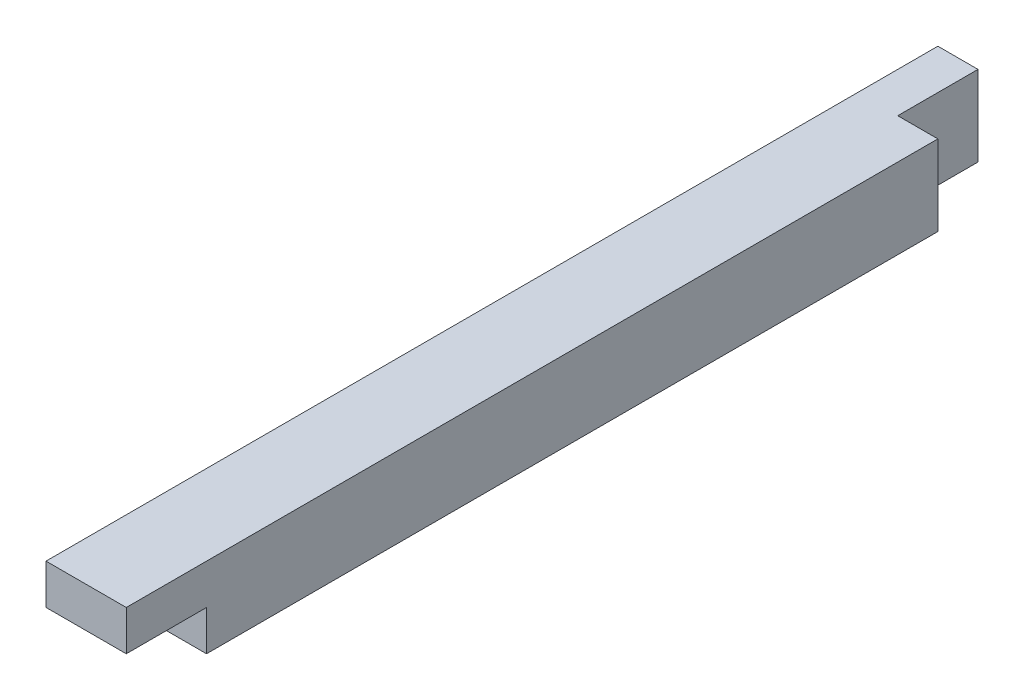
from build123d import *

# Parameters (mm, degrees)
SKETCH1_W           = 90
SKETCH1_H           = 90
BOSS_EXTRUDE1_DEPTH = 1000
SKETCH3_W           = 90
SKETCH3_H           = 90
CUT_EXTRUDE1_DEPTH  = 45
SKETCH4_W           = 90
SKETCH4_H           = 90
CUT_EXTRUDE2_DEPTH  = 45


with BuildPart() as part:
    # Sketch1 → Boss-Extrude1 (new body)
    with BuildSketch(Plane.XY):
        with Locations((45, 45)):
            Rectangle(SKETCH1_W, SKETCH1_H)
    extrude(amount=BOSS_EXTRUDE1_DEPTH)

    # Sketch3 → Cut-Extrude1 (cut)
    with BuildSketch(Plane.XZ):
        with Locations((45, 955)):
            Rectangle(SKETCH3_W, SKETCH3_H)
    extrude(amount=-CUT_EXTRUDE1_DEPTH, mode=Mode.SUBTRACT)

    # Sketch4 → Cut-Extrude2 (cut)
    with BuildSketch(Plane(origin=(90, 0, 0), x_dir=(0, 0, -1), z_dir=(1, 0, 0))):
        with Locations((-45, 45)):
            Rectangle(SKETCH4_W, SKETCH4_H)
    extrude(amount=-CUT_EXTRUDE2_DEPTH, mode=Mode.SUBTRACT)


solid = part.part
